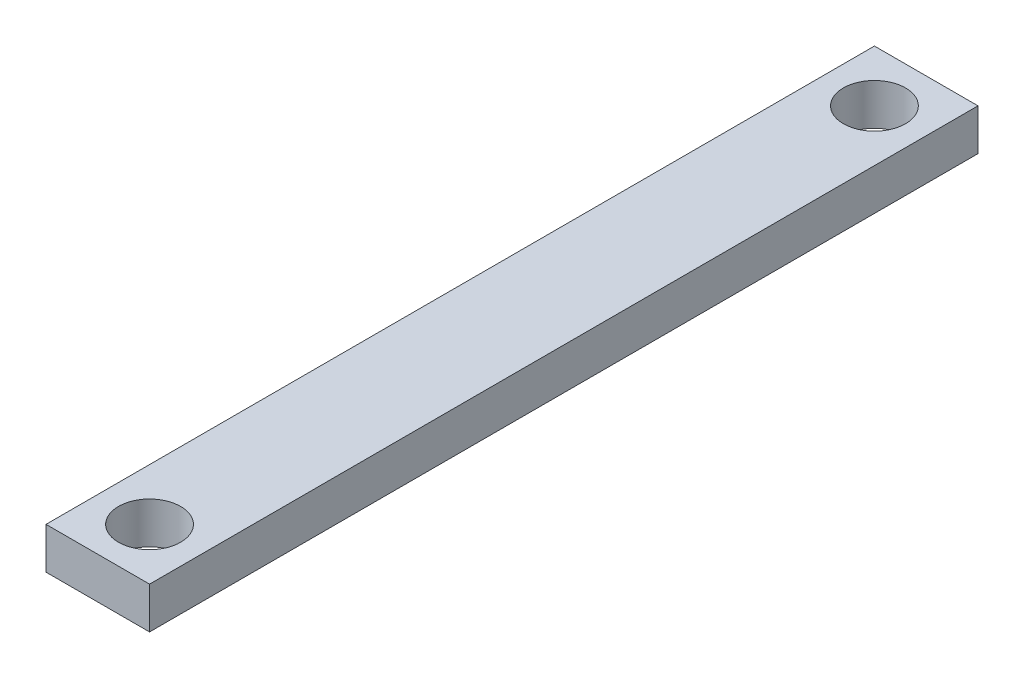
from build123d import *

# Parameters (mm, degrees)
SKETCH_1_W      = 5
SKETCH_1_H      = 40
SKETCH_1_R      = 1.5
EXTRUDE_1_DEPTH = 2


with BuildPart() as part:
    # 草图1 → 凸台-拉伸1 (new body)
    with BuildSketch(Plane(origin=(0, 0, 0), x_dir=(1, 0, 0), z_dir=(0, 1, 0))):
        with Locations((2.5, -20)):
            Rectangle(SKETCH_1_W, SKETCH_1_H)
        with Locations(Location((2.5, -2.5, 0), (0, 0, 270))):
            Circle(SKETCH_1_R, mode=Mode.SUBTRACT)
        with Locations(Location((2.5, -37.5, 0), (0, 0, 270))):
            Circle(SKETCH_1_R, mode=Mode.SUBTRACT)
    extrude(amount=EXTRUDE_1_DEPTH)


solid = part.part
